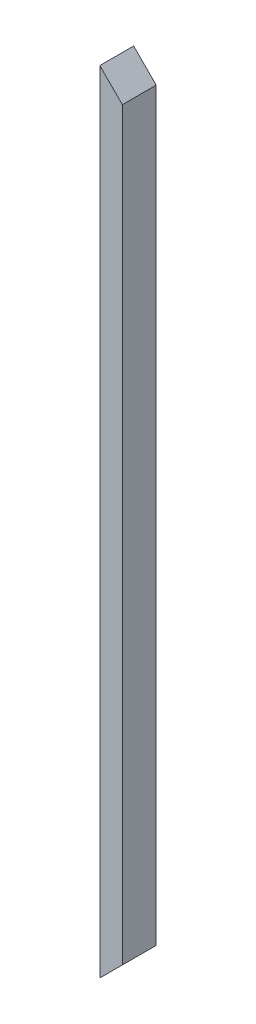
from build123d import *

# Parameters (mm, degrees)
BOSS_EXTRU_1_DEPTH = 30


with BuildPart() as part:
    # Esquisse1 → Boss.-Extru.1 (new body)
    with BuildSketch(Plane.XY):
        Polygon((-350, 350), (-350, -350), (-330, -330), (-330, 330), align=None)
    extrude(amount=BOSS_EXTRU_1_DEPTH)


solid = part.part
